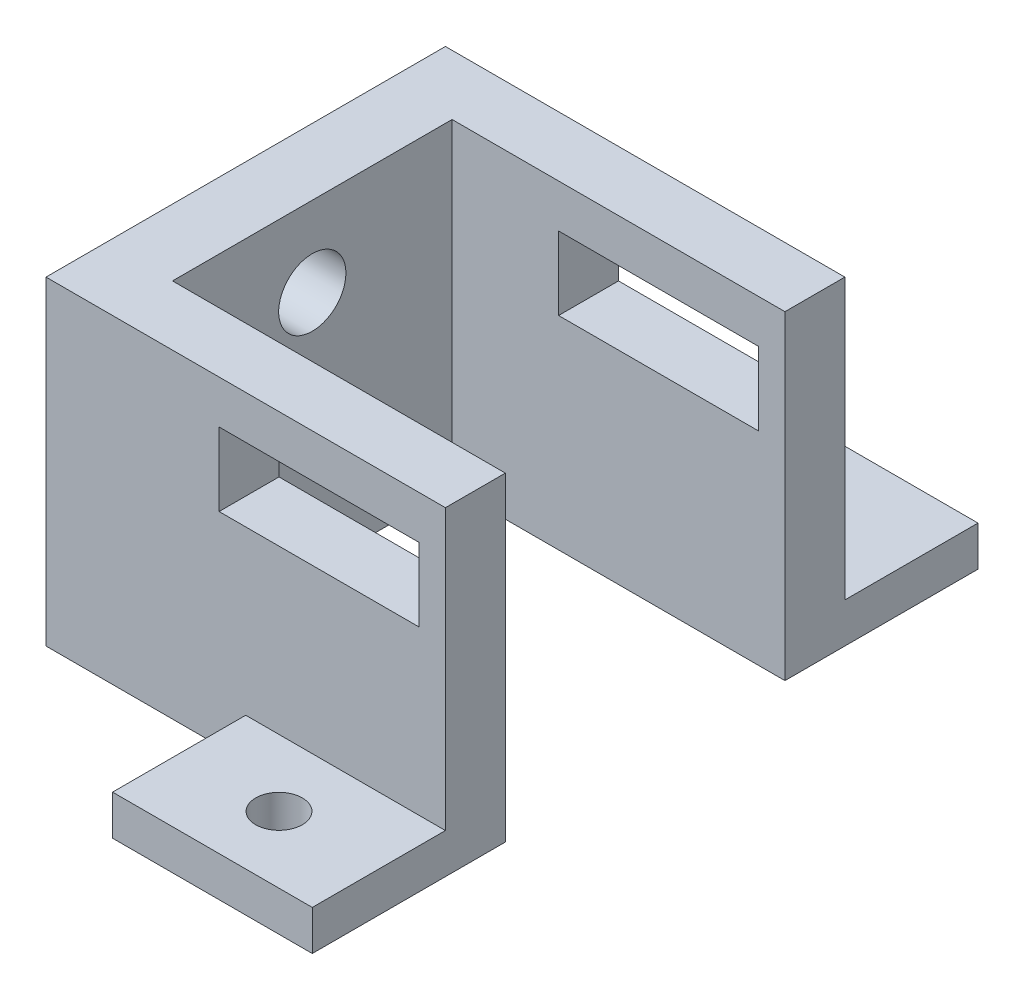
from build123d import *

# Parameters (mm, degrees)
SKETCH1_W           = 30
SKETCH1_H           = 24
SKETCH1_W_2         = 15
SKETCH1_H_2         = 5.5
BOSS_EXTRUDE1_DEPTH = 30
SKETCH2_W           = 21
SKETCH2_H           = 24
CUT_EXTRUDE1_DEPTH  = 25
SKETCH3_R           = 2.525
CUT_EXTRUDE2_DEPTH  = 41.853396432
SKETCH_1_W          = 15
SKETCH_1_H          = 3
EXTRUDE_1_DEPTH     = 10
SKETCH_2_W          = 15
SKETCH_2_H          = 3
EXTRUDE_2_DEPTH     = 10
SKETCH_3_R          = 1.75
CUT_EXTRUDE_1_DEPTH = 48.602520942
SKETCH_4_R          = 1.75
CUT_EXTRUDE_2_DEPTH = 48.602520942


with BuildPart() as part:
    # Sketch1 → Boss-Extrude1 (new body)
    with BuildSketch(Plane.XY):
        Rectangle(SKETCH1_W, SKETCH1_H)
        with Locations((5.5, 6)):
            Rectangle(SKETCH1_W_2, SKETCH1_H_2, mode=Mode.SUBTRACT)
    extrude(amount=BOSS_EXTRUDE1_DEPTH)

    # Sketch2 → Cut-Extrude1 (cut)
    with BuildSketch(Plane(origin=(15, 0, 0), x_dir=(0, 0, -1), z_dir=(1, 0, 0))):
        with Locations((-15, 0)):
            Rectangle(SKETCH2_W, SKETCH2_H)
    extrude(amount=-CUT_EXTRUDE1_DEPTH, mode=Mode.SUBTRACT)

    # Sketch3 → Cut-Extrude2 (cut, through all)
    with BuildSketch(Plane(origin=(-10, 0, 0), x_dir=(0, 0, -1), z_dir=(1, 0, 0))):
        with Locations((-15, 6)):
            Circle(SKETCH3_R)
    extrude(amount=-CUT_EXTRUDE2_DEPTH, mode=Mode.SUBTRACT)

    # Эскиз1 → Бобышка-Вытянуть1 (add)
    with BuildSketch(Plane.XY.offset(30)):
        with Locations((7.5, -10.5)):
            Rectangle(SKETCH_1_W, SKETCH_1_H)
    extrude(amount=EXTRUDE_1_DEPTH)

    # Эскиз2 → Бобышка-Вытянуть2 (add)
    with BuildSketch(Plane(origin=(0, 0, 0), x_dir=(-1, 0, 0), z_dir=(0, 0, -1))):
        with Locations((-7.5, -10.5)):
            Rectangle(SKETCH_2_W, SKETCH_2_H)
    extrude(amount=EXTRUDE_2_DEPTH)

    # Эскиз3 → Вырез-Вытянуть1 (cut, through all)
    with BuildSketch(Plane(origin=(0, -9, 0), x_dir=(1, 0, 0), z_dir=(0, 1, 0))):
        with Locations(Location((7.5, -35, 0), (0, 0, 270))):
            Circle(SKETCH_3_R)
    extrude(amount=-CUT_EXTRUDE_1_DEPTH, mode=Mode.SUBTRACT)

    # Эскиз4 → Вырез-Вытянуть2 (cut, through all)
    with BuildSketch(Plane(origin=(0, -9, 0), x_dir=(1, 0, 0), z_dir=(0, 1, 0))):
        with Locations(Location((7.5, 5, 0), (0, 0, 270))):
            Circle(SKETCH_4_R)
    extrude(amount=-CUT_EXTRUDE_2_DEPTH, mode=Mode.SUBTRACT)


solid = part.part
